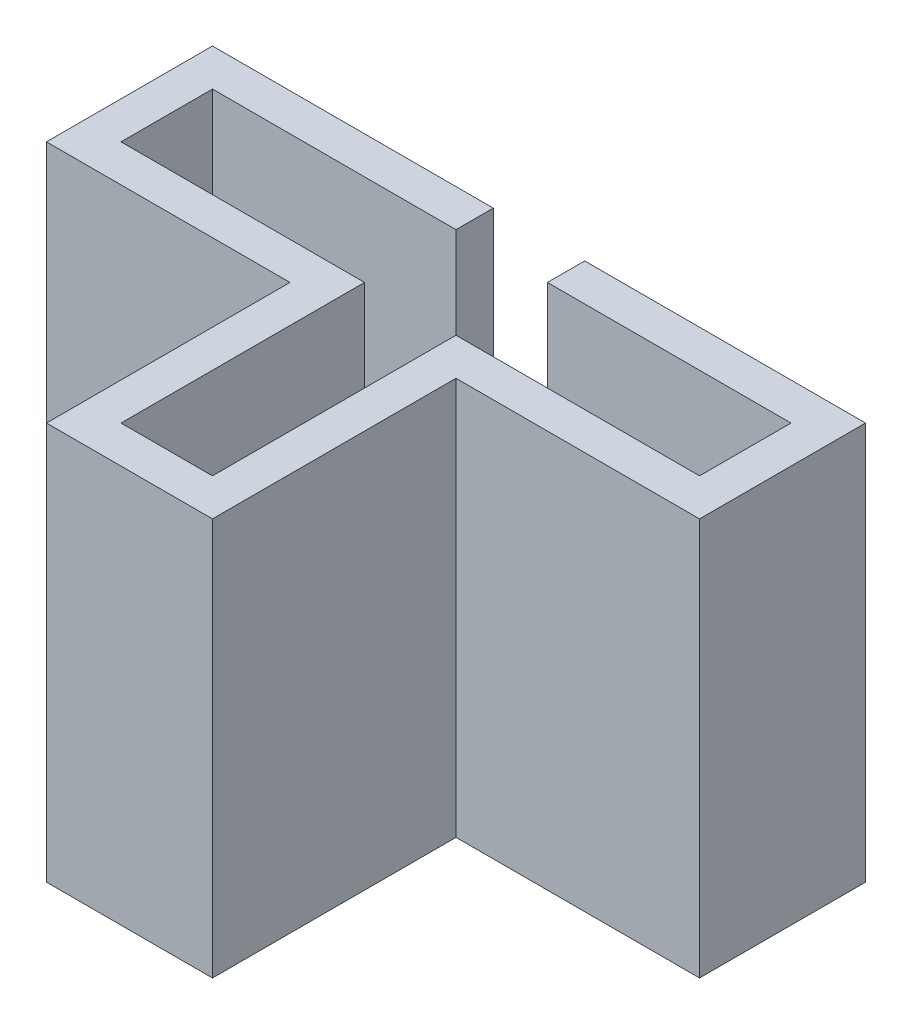
from build123d import *

# Parameters (mm, degrees)
PROFILE_EXTRUDE_DEPTH = 50.8


with BuildPart() as part:
    # Profile Sketch → Profile Extrude (new body)
    with BuildSketch(Plane(origin=(0, 0, 0), x_dir=(1, 0, 0), z_dir=(0, 1, 0))):
        Polygon((-41.7195, 10.6045), (-41.7195, -10.6045), (-10.6045, -10.6045), (-10.6045, -41.7195), (10.6045, -41.7195), (10.6045, -10.6045), (41.7195, -10.6045), (41.7195, 10.6045), (5.842, 10.6045), (5.842, 5.842), (36.957, 5.842), (36.957, -5.842), (5.842, -5.842), (5.842, -36.957), (-5.842, -36.957), (-5.842, -5.842), (-36.957, -5.842), (-36.957, 5.842), (-5.842, 5.842), (-5.842, 10.6045), align=None)
    extrude(amount=PROFILE_EXTRUDE_DEPTH)


solid = part.part
